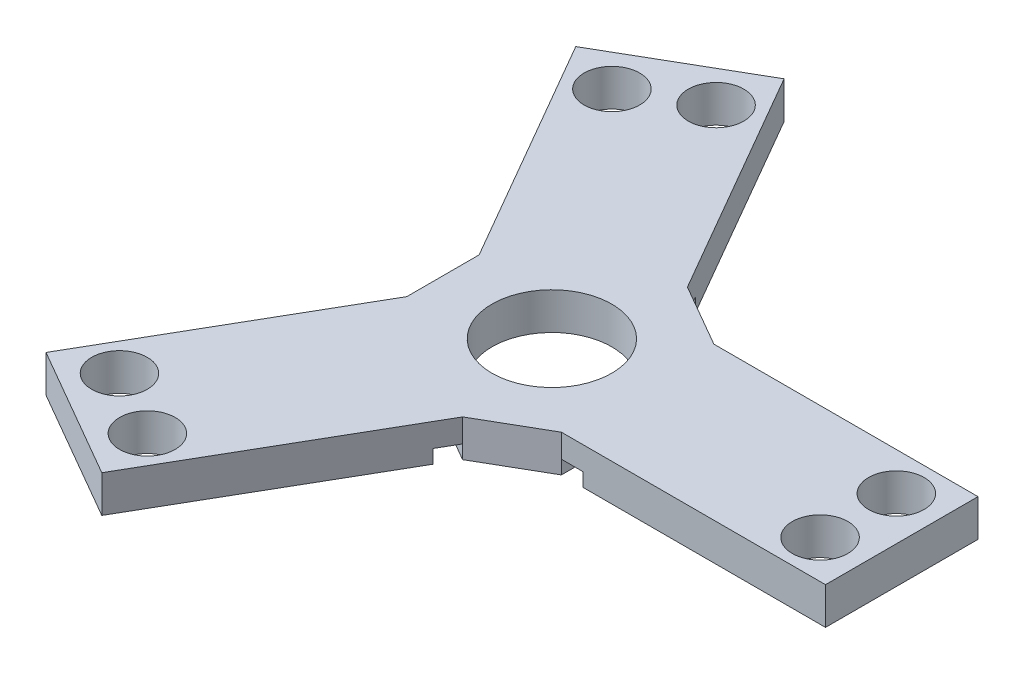
from build123d import *

# Parameters (mm, degrees)
SKETCH1_R           = 5.5
BOSS_EXTRUDE1_DEPTH = 3.4
SKETCH3_R           = 2.55
CUT_EXTRUDE1_DEPTH  = 45.994538027
SKETCH4_W           = 2
SKETCH4_H           = 14
CUT_EXTRUDE2_DEPTH  = 1.25


with BuildPart() as part:
    # Sketch1 → Boss-Extrude1 (new body)
    # profile 1 of 7: a face of its own
    with BuildSketch(Plane(origin=(0, 0, 0), x_dir=(1, 0, 0), z_dir=(0, 1, 0))):
        Polygon((7.875644347, -7), (7.875644347, 7), (2.124355653, 10.320508076), (-10, 3.320508076), (-10, -3.320508076), (2.124355653, -10.320508076), align=None)
        with Locations(Location((0, 0, 0), (0, 0, 270))):
            Circle(SKETCH1_R, mode=Mode.SUBTRACT)
    # profile 2 of 7: a face of its own
    with BuildSketch(Plane(origin=(0, 0, 0), x_dir=(1, 0, 0), z_dir=(0, 1, 0))):
        Polygon((7.875644347, -7), (20, 0), (7.875644347, 7), align=None)
    # profile 3 of 7: a face of its own
    with BuildSketch(Plane(origin=(0, 0, 0), x_dir=(1, 0, 0), z_dir=(0, 1, 0))):
        Polygon((7.875644347, 7), (20, 0), (7.875644347, -7), (32.124355653, -7), (32.124355653, 7), align=None)
    # profile 4 of 7: a face of its own
    with BuildSketch(Plane(origin=(0, 0, 0), x_dir=(1, 0, 0), z_dir=(0, 1, 0))):
        Polygon((-10, -17.320508076), (2.124355653, -10.320508076), (-10, -3.320508076), align=None)
    # profile 5 of 7: a face of its own
    with BuildSketch(Plane(origin=(0, 0, 0), x_dir=(1, 0, 0), z_dir=(0, 1, 0))):
        Polygon((-10, -31.320508076), (2.124355653, -10.320508076), (-10, -17.320508076), (-10, -3.320508076), (-22.124355653, -24.320508076), align=None)
    # profile 6 of 7: a face of its own
    with BuildSketch(Plane(origin=(0, 0, 0), x_dir=(1, 0, 0), z_dir=(0, 1, 0))):
        Polygon((-10, 3.320508076), (2.124355653, 10.320508076), (-10, 17.320508076), align=None)
    # profile 7 of 7: a face of its own
    with BuildSketch(Plane(origin=(0, 0, 0), x_dir=(1, 0, 0), z_dir=(0, 1, 0))):
        Polygon((-10, 17.320508076), (2.124355653, 10.320508076), (-10, 31.320508076), (-22.124355653, 24.320508076), (-10, 3.320508076), align=None)
    extrude(amount=BOSS_EXTRUDE1_DEPTH)

    # Sketch3 → Cut-Extrude1 (cut, through all)
    with BuildSketch(Plane(origin=(0, 3.4, 0), x_dir=(1, 0, 0), z_dir=(0, 1, 0))):
        with Locations(Location((28.124355653, 3.5, 0), (0, 0, 270))):
            Circle(SKETCH3_R)
        with Locations(Location((28.124355653, -3.5, 0), (0, 0, 90))):
            Circle(SKETCH3_R)
        with Locations(Location((-11.031088913, -26.106406461, 0), (0, 0, 270))):
            Circle(SKETCH3_R)
        with Locations(Location((-17.09326674, -22.606406461, 0), (0, 0, 90))):
            Circle(SKETCH3_R)
        with Locations(Location((-17.09326674, 22.606406461, 0), (0, 0, 270))):
            Circle(SKETCH3_R)
        with Locations(Location((-11.031088913, 26.106406461, 0), (0, 0, 90))):
            Circle(SKETCH3_R)
    extrude(amount=-CUT_EXTRUDE1_DEPTH, mode=Mode.SUBTRACT)

    # Sketch4 → Cut-Extrude2 (cut)
    with BuildSketch(Plane.XZ):
        with Locations((8.875644347, 0)):
            Rectangle(SKETCH4_W, SKETCH4_H)
        Polygon((-11, -5.052558883), (-10, -3.320508076), (2.124355653, -10.320508076), (1.124355653, -12.052558883), align=None)
        Polygon((1.124355653, 12.052558883), (2.124355653, 10.320508076), (-10, 3.320508076), (-11, 5.052558883), align=None)
    extrude(amount=-CUT_EXTRUDE2_DEPTH, mode=Mode.SUBTRACT)


solid = part.part
